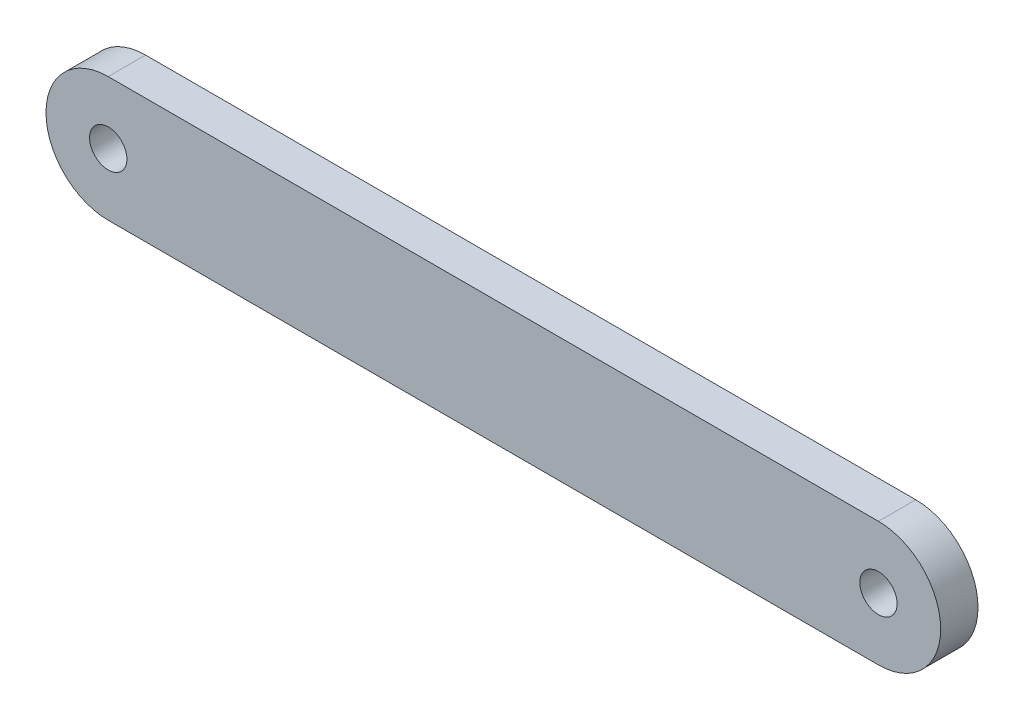
from build123d import *

# Parameters (mm, degrees)
SKETCH1_R           = 1.5
BOSS_EXTRUDE1_DEPTH = 3


with BuildPart() as part:
    # Sketch1 → Boss-Extrude1 (new body)
    with BuildSketch(Plane.XY):
        with BuildLine():
            Line((0, 5), (61.9, 5))
            ThreePointArc((61.9, 5), (66.9, 0), (61.9, -5))
            Line((61.9, -5), (0, -5))
            ThreePointArc((0, -5), (-5, 0), (0, 5))
        make_face()
        Circle(SKETCH1_R, mode=Mode.SUBTRACT)
        with Locations((61.9, 0)):
            Circle(SKETCH1_R, mode=Mode.SUBTRACT)
    extrude(amount=BOSS_EXTRUDE1_DEPTH)


solid = part.part
